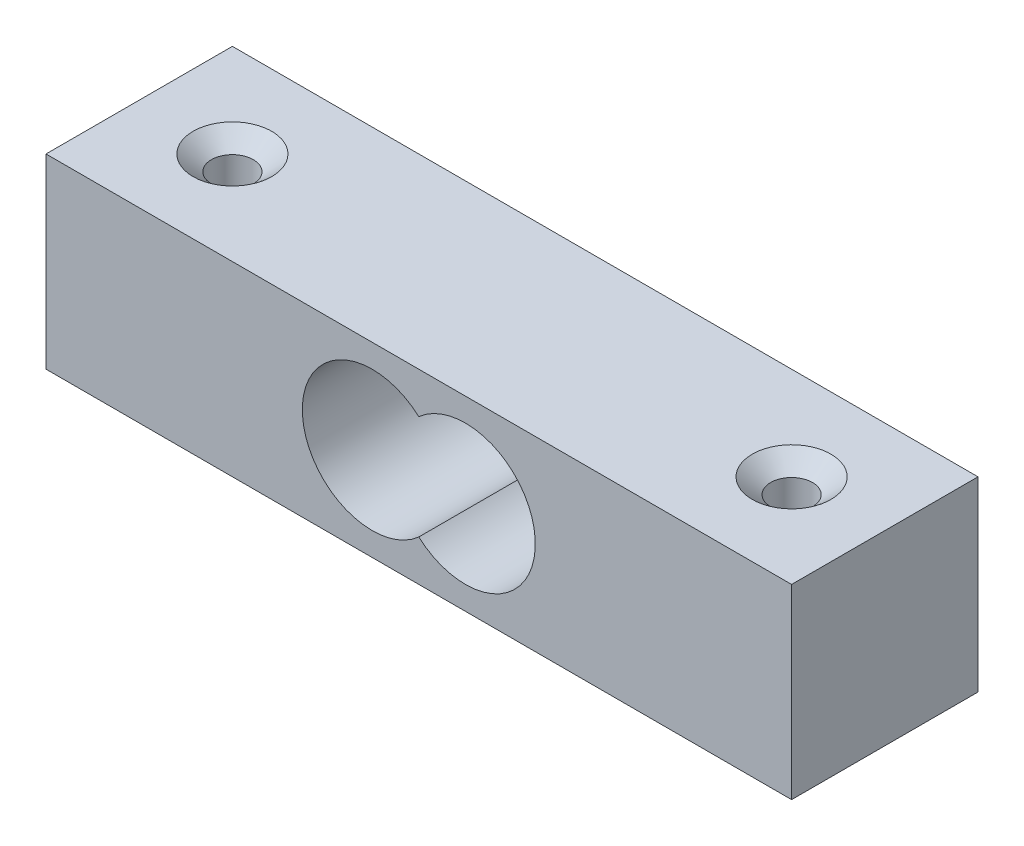
from build123d import *

# Parameters (mm, degrees)
SKETCH1_W                                         = 80
SKETCH1_H                                         = 20
BOSS_EXTRUDE1_DEPTH                               = 20
SKETCH2_R                                         = 7.5
CUT_EXTRUDE1_DEPTH                                = 20
CSK_FOR_8_FLAT_HEAD_MACHINE_SCREW_100_D           = 4.4958
CSK_FOR_8_FLAT_HEAD_MACHINE_SCREW_100_CSINK_D     = 8.4328
CSK_FOR_8_FLAT_HEAD_MACHINE_SCREW_100_CSINK_ANGLE = 100


with BuildPart() as part:
    # Sketch1 → Boss-Extrude1 (new body)
    with BuildSketch(Plane(origin=(0, 0, 0), x_dir=(1, 0, 0), z_dir=(0, 1, 0))):
        Rectangle(SKETCH1_W, SKETCH1_H)
    extrude(amount=BOSS_EXTRUDE1_DEPTH)

    # Sketch2 → Cut-Extrude1 (cut)
    with BuildSketch(Plane.XY.offset(10)):
        with Locations((-5, 10)):
            Circle(SKETCH2_R)
        with Locations((5, 10)):
            Circle(SKETCH2_R)
    extrude(amount=-CUT_EXTRUDE1_DEPTH, mode=Mode.SUBTRACT)

    # CSK for #8 Flat Head Machine Screw (100)1 (through all)
    with Locations(Plane(origin=(0, 20, 0), x_dir=(1, 0, 0), z_dir=(0, 1, 0))):
        with Locations((-30, 0), (30, 0)):
            CounterSinkHole(CSK_FOR_8_FLAT_HEAD_MACHINE_SCREW_100_D / 2, CSK_FOR_8_FLAT_HEAD_MACHINE_SCREW_100_CSINK_D / 2, counter_sink_angle=CSK_FOR_8_FLAT_HEAD_MACHINE_SCREW_100_CSINK_ANGLE)


solid = part.part
